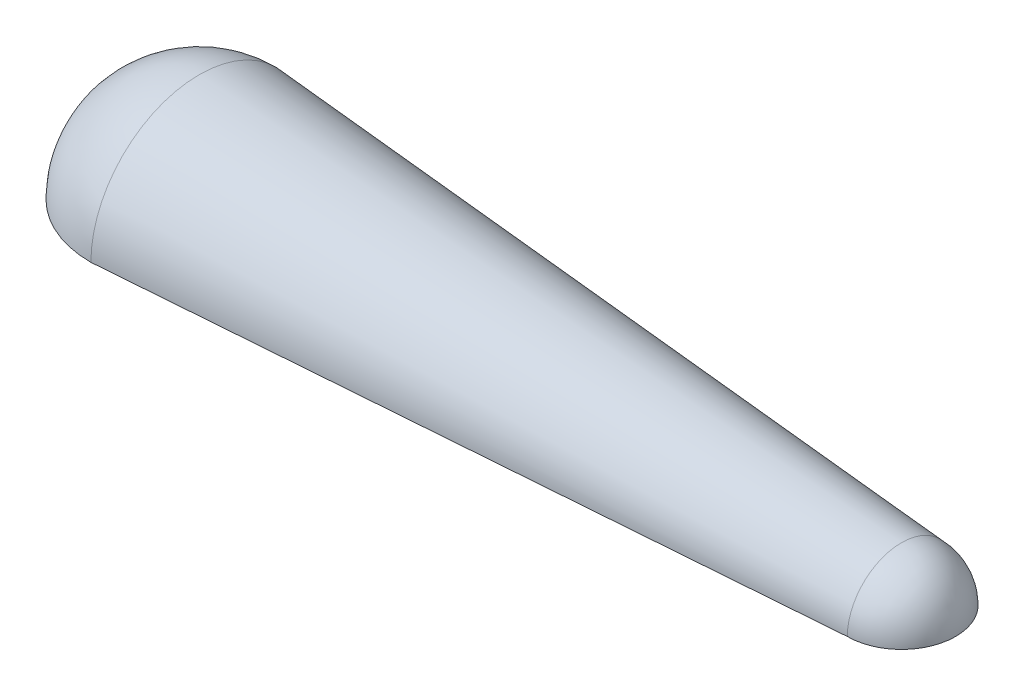
from build123d import *

# Parameters (mm, degrees)
REVOLVE1_ANGLE     = 180
SKETCH3_R          = 1
CUT_EXTRUDE1_DEPTH = 2.5


with BuildPart() as part:
    # Sketch1 → Revolve1 (revolve)
    with BuildSketch(Plane(origin=(0, 0, 0), x_dir=(1, 0, 0), z_dir=(0, 1, 0))):
        with BuildLine():
            Line((0, 18.516950365), (120, 9.258475183))
            ThreePointArc((120, 9.258475183), (126.546730585, 6.546730585), (129.258475183, 0))
            Line((129.258475183, 0), (126, 0))
            ThreePointArc((126, 0), (124.242640687, 4.242640687), (120, 6))
            Line((120, 6), (0, 14))
            ThreePointArc((0, 14), (-9.899494937, 9.899494937), (-14, 0))
            Line((-14, 0), (-18.516950365, 0))
            ThreePointArc((-18.516950365, 0), (-13.09346117, 13.09346117), (0, 18.516950365))
        make_face()
    revolve(axis=Axis((-18.516950365, 0, 0), (1, 0, 0)), revolution_arc=REVOLVE1_ANGLE)

    # Sketch3 → Cut-Extrude1 (cut)
    with BuildSketch(Plane.XZ):
        with Locations(Location((-16, 0, 0), (0, 0, 270))):
            Circle(SKETCH3_R)
        with Locations(Location((0, 16, 0), (0, 0, 270))):
            Circle(SKETCH3_R)
        with Locations(Location((0, -16, 0), (0, 0, 270))):
            Circle(SKETCH3_R)
        with Locations(Location((127.5, 0, 0), (0, 0, 270))):
            Circle(SKETCH3_R)
    extrude(amount=-CUT_EXTRUDE1_DEPTH, mode=Mode.SUBTRACT)


solid = part.part
